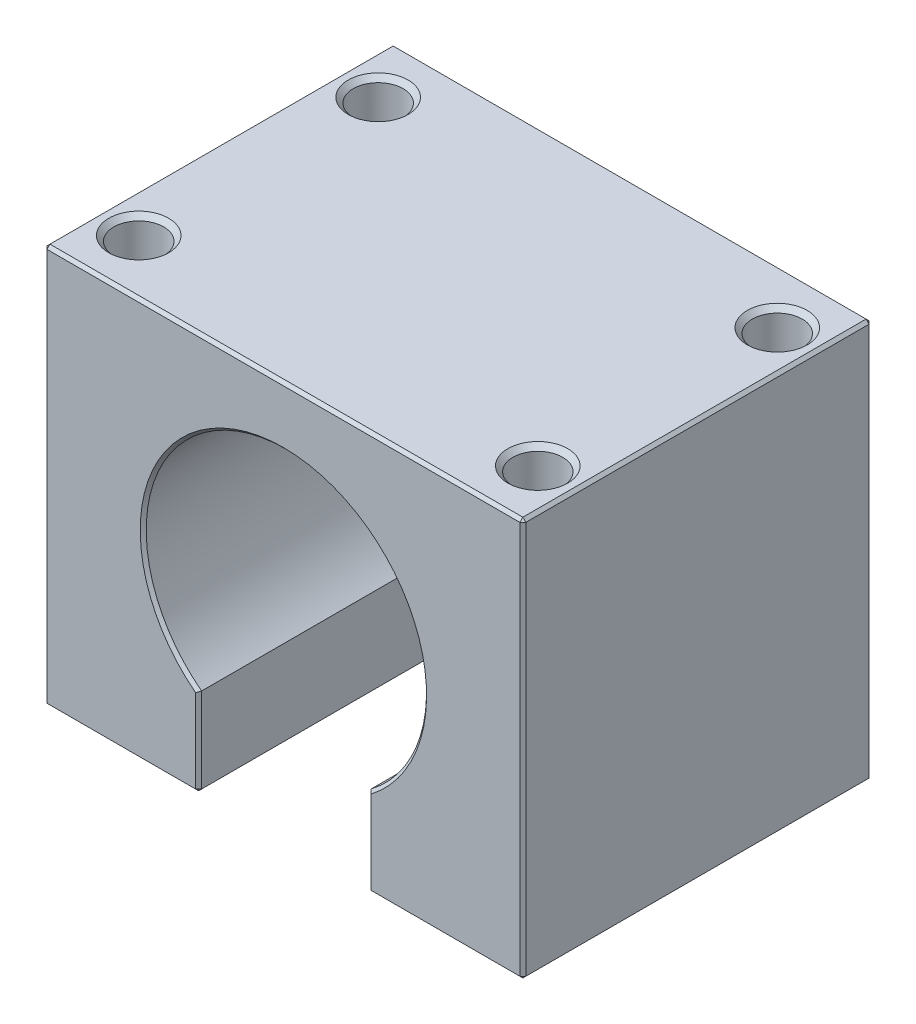
from build123d import *

# Parameters (mm, degrees)
BOSS_EXTRUDE1_DEPTH = 35
CHAMFER2_SIZE       = 0.3
SKETCH2_R           = 2.5
CUT_EXTRUDE1_DEPTH  = 17
SKETCH3_R           = 2.5
CUT_EXTRUDE2_DEPTH  = 20
CHAMFER3_SIZE       = 0.5


with BuildPart() as part:
    # Sketch1 → Boss-Extrude1 (new body)
    with BuildSketch(Plane.XY):
        with BuildLine():
            Line((24, 0), (-24, 0))
            Line((-24, 0), (-24, -40))
            Line((-24, -40), (-8.5, -40))
            Line((-8.5, -40), (-8.5, -31.187157816))
            ThreePointArc((-8.5, -31.187157816), (0, -5.95), (8.5, -31.187157816))
            Line((8.5, -31.187157816), (8.5, -40))
            Line((8.5, -40), (24, -40))
            Line((24, -40), (24, 0))
        make_face()
    extrude(amount=BOSS_EXTRUDE1_DEPTH)

    # Chamfer2
    chamfer2_edges = [part.edges().sort_by_distance(p)[0] for p in [
        (0, -5.95, 35),
        (-8.5, -35.593578908, 0),
        (-16.25, -40, 0),
        (8.5, -35.593578908, 35),
        (-24, -40, 17.5),
        (-24, 0, 17.5),
        (24, 0, 17.5),
        (24, -40, 17.5),
        (8.5, -40, 17.5),
        (-8.5, -40, 17.5),
        (16.25, -40, 35),
        (24, -20, 35),
        (0, 0, 35),
        (-24, -20, 35),
        (-16.25, -40, 35),
        (-8.5, -35.593578908, 35),
        (-24, -20, 0),
        (0, 0, 0),
        (24, -20, 0),
        (16.25, -40, 0),
        (8.5, -35.593578908, 0),
        (0, -5.95, 0),
    ]]
    chamfer(chamfer2_edges, length=CHAMFER2_SIZE)

    # Sketch2 → Cut-Extrude1 (cut)
    with BuildSketch(Plane(origin=(0, 0, 0), x_dir=(1, 0, 0), z_dir=(0, 1, 0))):
        with Locations(Location((-20, -5.5, 0), (0, 0, 180))):
            Circle(SKETCH2_R)
        with Locations((20, -5.5)):
            Circle(SKETCH2_R)
        with Locations(Location((20, -29.5, 0), (0, 0, 180))):
            Circle(SKETCH2_R)
        with Locations((-20, -29.5)):
            Circle(SKETCH2_R)
    extrude(amount=-CUT_EXTRUDE1_DEPTH, mode=Mode.SUBTRACT)

    # Sketch3 → Cut-Extrude2 (cut)
    with BuildSketch(Plane(origin=(0, 0, 0), x_dir=(-1, 0, 0), z_dir=(0, 0, -1))):
        with Locations((-13.435028843, -33.435028843)):
            Circle(SKETCH3_R)
        with Locations(Location((13.435028843, -33.435028843, 0), (0, 0, 180))):
            Circle(SKETCH3_R)
        with Locations((13.435028843, -6.564971157)):
            Circle(SKETCH3_R)
        with Locations(Location((-13.435028843, -6.564971157, 0), (0, 0, 180))):
            Circle(SKETCH3_R)
        with Locations((-19, -20)):
            Circle(SKETCH3_R)
        with Locations(Location((19, -20, 0), (0, 0, 180))):
            Circle(SKETCH3_R)
    extrude(amount=-CUT_EXTRUDE2_DEPTH, mode=Mode.SUBTRACT)

    # Chamfer3
    chamfer3_edges = [part.edges().sort_by_distance(p)[0] for p in [
        (22.5, 0, 29.5),
        (-22.5, 0, 29.5),
        (15.935028843, -33.435028843, 0),
        (-15.935028843, -33.435028843, 0),
        (-10.935028843, -6.564971157, 0),
        (-21.5, -20, 0),
        (21.5, -20, 0),
        (-17.5, 0, 5.5),
        (17.5, 0, 5.5),
    ]]
    chamfer(chamfer3_edges, length=CHAMFER3_SIZE)


solid = part.part
